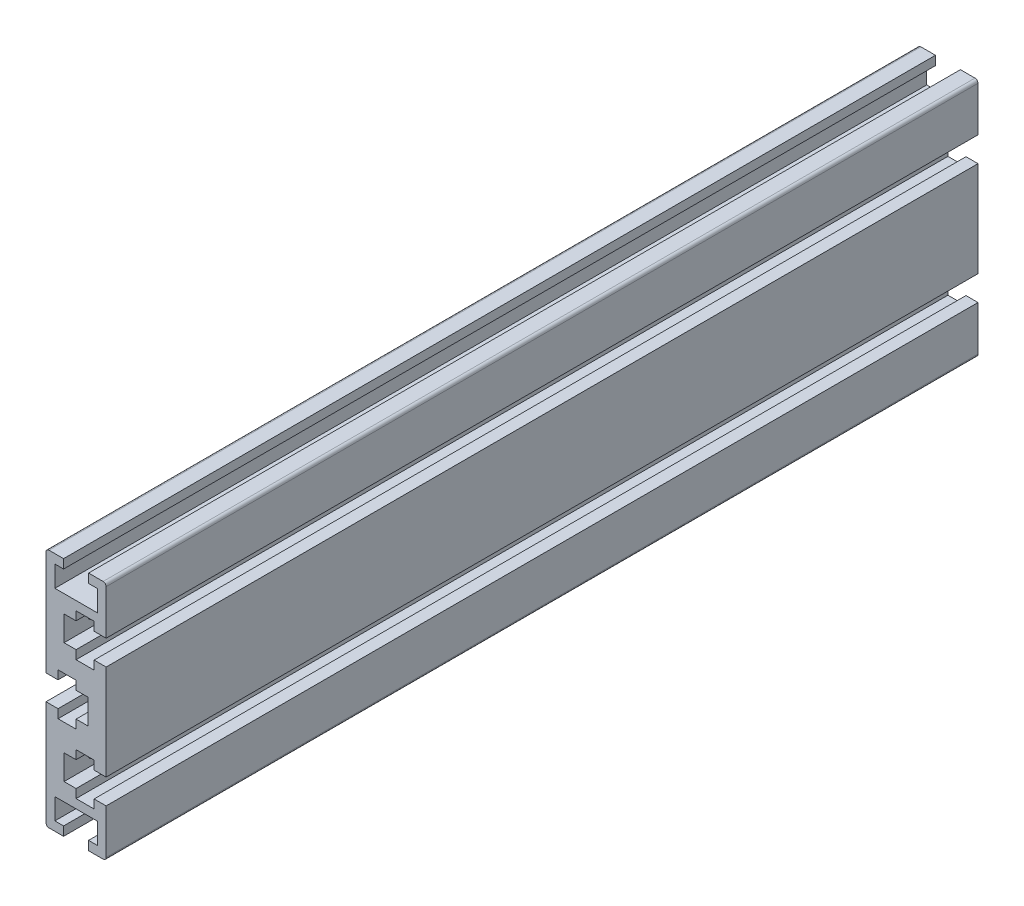
from build123d import *

# Parameters (mm, degrees)
EXTRUDE_1_DEPTH         = 290
HOLE_WIZARD_4_5_4_5_1_D = 4.5
HOLE_WIZARD_4_5_4_5_2_D = 4.5
HOLE_WIZARD_4_5_4_5_3_D = 4.5
HOLE_WIZARD_4_5_4_5_4_D = 4.5


with BuildPart() as part:
    # Sketch1 → 凸台-拉伸1 (new body)
    with BuildSketch(Plane.XY):
        with BuildLine():
            Line((-9, 40), (-4.15, 40))
            Line((-4.15, 40), (-4.15, 37))
            Line((-4.15, 37), (-7.05, 37))
            Line((-7.05, 37), (-7.05, 30))
            Line((-7.05, 30), (7.05, 30))
            Line((7.05, 30), (7.05, 37))
            Line((7.05, 37), (4.15, 37))
            Line((4.15, 37), (4.15, 40))
            Line((4.15, 40), (9, 40))
            ThreePointArc((9, 40), (9.707106781, 39.707106781), (10, 39))
            Line((10, 39), (10, 24.15))
            Line((10, 24.15), (6, 24.15))
            Line((6, 24.15), (6, 27.05))
            Line((6, 27.05), (0, 27.05))
            Line((0, 27.05), (0, 24.15))
            Line((0, 24.15), (-4, 24.15))
            Line((-4, 24.15), (-4, 15.85))
            Line((-4, 15.85), (0, 15.85))
            Line((0, 15.85), (0, 12.95))
            Line((0, 12.95), (6, 12.95))
            Line((6, 12.95), (6, 15.85))
            Line((6, 15.85), (10, 15.85))
            Line((10, 15.85), (10, -15.85))
            Line((10, -15.85), (6, -15.85))
            Line((6, -15.85), (6, -12.95))
            Line((6, -12.95), (0, -12.95))
            Line((0, -12.95), (0, -15.85))
            Line((0, -15.85), (-4, -15.85))
            Line((-4, -15.85), (-4, -24.15))
            Line((-4, -24.15), (0, -24.15))
            Line((0, -24.15), (0, -27.05))
            Line((0, -27.05), (6, -27.05))
            Line((6, -27.05), (6, -24.15))
            Line((6, -24.15), (10, -24.15))
            Line((10, -24.15), (10, -39))
            ThreePointArc((10, -39), (9.707106781, -39.707106781), (9, -40))
            Line((9, -40), (4.15, -40))
            Line((4.15, -40), (4.15, -37))
            Line((4.15, -37), (7.05, -37))
            Line((7.05, -37), (7.05, -30))
            Line((7.05, -30), (-7.05, -30))
            Line((-7.05, -30), (-7.05, -37))
            Line((-7.05, -37), (-4.15, -37))
            Line((-4.15, -37), (-4.15, -40))
            Line((-4.15, -40), (-9, -40))
            ThreePointArc((-9, -40), (-9.707106781, -39.707106781), (-10, -39))
            Line((-10, -39), (-10, -4.15))
            Line((-10, -4.15), (-6, -4.15))
            Line((-6, -4.15), (-6, -7.05))
            Line((-6, -7.05), (0, -7.05))
            Line((0, -7.05), (0, -4.15))
            Line((0, -4.15), (4, -4.15))
            Line((4, -4.15), (4, 4.15))
            Line((4, 4.15), (0, 4.15))
            Line((0, 4.15), (0, 7.05))
            Line((0, 7.05), (-6, 7.05))
            Line((-6, 7.05), (-6, 4.15))
            Line((-6, 4.15), (-10, 4.15))
            Line((-10, 4.15), (-10, 39))
            ThreePointArc((-10, 39), (-9.707106781, 39.707106781), (-9, 40))
        make_face()
    extrude(amount=EXTRUDE_1_DEPTH)

    # Ø4.5 (4.5) 直径孔1 (through all)
    with Locations(Plane.ZY.offset(10)):
        with Locations((10, 20)):
            Hole(HOLE_WIZARD_4_5_4_5_1_D / 2)

    # Ø4.5 (4.5) 直径孔2 (through all)
    with Locations(Plane.ZY.offset(10)):
        with Locations((280, 20)):
            Hole(HOLE_WIZARD_4_5_4_5_2_D / 2)

    # Ø4.5 (4.5) 直径孔3 (through all)
    with Locations(Plane.ZY.offset(10)):
        with Locations((10, -20)):
            Hole(HOLE_WIZARD_4_5_4_5_3_D / 2)

    # Ø4.5 (4.5) 直径孔4 (through all)
    with Locations(Plane.ZY.offset(10)):
        with Locations((280, -20)):
            Hole(HOLE_WIZARD_4_5_4_5_4_D / 2)


solid = part.part
